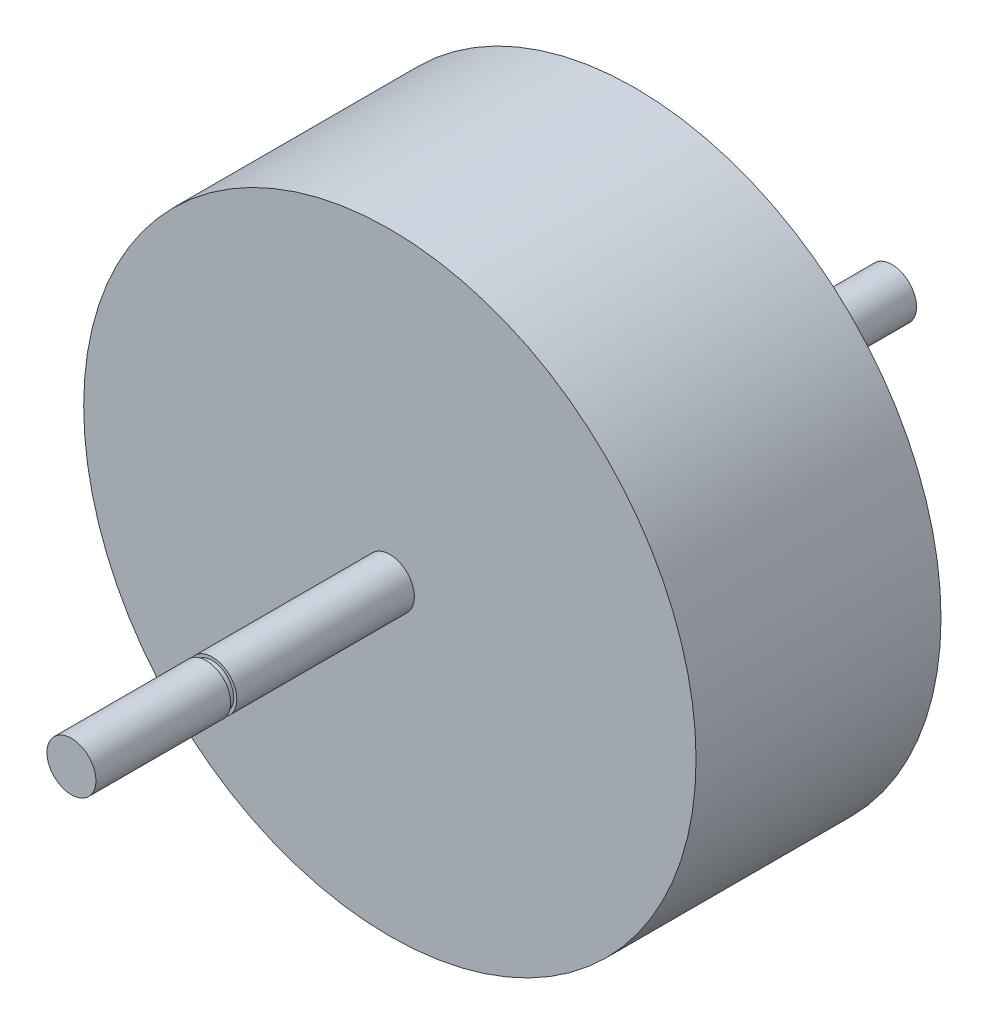
from build123d import *

# Parameters (mm, degrees)
SKETCH1_R                = 50
BOSS_EXTRUDE1_DEPTH      = 20
BOSS_EXTRUDE2_DEPTH      = 52
BOSS_EXTRUDE2_DEPTH_BACK = 82
SKETCH2_R                = 4
SKETCH3_R                = 4
SKETCH3_R_2              = 3.5
CUT_EXTRUDE1_DEPTH       = 1


with BuildPart() as part:
    # Sketch1 → Boss-Extrude1 (new, symmetric)
    with BuildSketch(Plane.XY):
        Circle(SKETCH1_R)
    extrude(amount=BOSS_EXTRUDE1_DEPTH, both=True)

    # Sketch2 → Boss-Extrude2 (add, two sides: drawn at the far end of the back side and taken through both)
    with BuildSketch(Plane.XY.offset(20).offset(-BOSS_EXTRUDE2_DEPTH_BACK)):
        Circle(SKETCH2_R)
    extrude(amount=BOSS_EXTRUDE2_DEPTH + BOSS_EXTRUDE2_DEPTH_BACK)

    # Sketch3 → Cut-Extrude1 (cut)
    with BuildSketch(Plane(origin=(0, 0, -50), x_dir=(-1, 0, 0), z_dir=(0, 0, -1))):
        with Locations(Location((0, 0, 0), (0, 0, 180))):
            Circle(SKETCH3_R)
        Circle(SKETCH3_R_2, mode=Mode.SUBTRACT)
    cut_extrude1 = extrude(amount=-CUT_EXTRUDE1_DEPTH, mode=Mode.SUBTRACT)

    # Mirror1: Cut-Extrude1 across plane
    add(cut_extrude1.mirror(Plane.XY), mode=Mode.SUBTRACT)


solid = part.part
